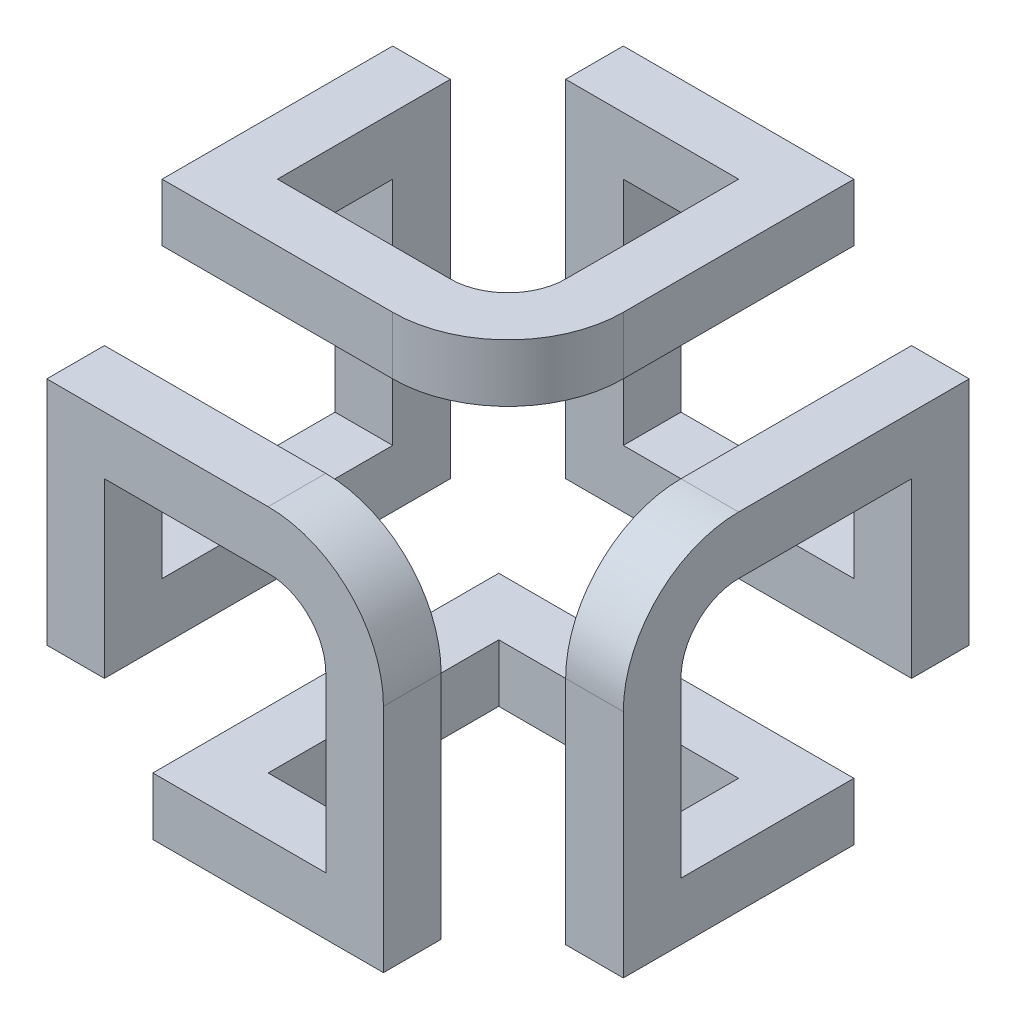
from build123d import *

# Parameters (mm, degrees)
SKETCH_1_W      = 10
SKETCH_1_H      = 10
EXTRUDE_1_DEPTH = 10
EXTRUDE_2_DEPTH = 10
EXTRUDE_3_DEPTH = 10
EXTRUDE_4_DEPTH = 10
EXTRUDE_5_DEPTH = 10
EXTRUDE_6_DEPTH = 10
FILLET_3_R      = 20
FILLET_4_R      = 10
FILLET_5_R      = 20
FILLET_6_R      = 20
FILLET_7_R      = 10
FILLET_8_R      = 10


with BuildPart() as part:
    # 草图1 → 凸台-拉伸1 (new body)
    with BuildSketch(Plane.XY):
        Polygon((0, 60), (0, 30), (10, 30), (10, 50), (48.396471527, 50), (48.396471527, 10), (28.396471527, 10), (28.396471527, 0), (58.396471527, 0), (58.396471527, 60), align=None)
        with Locations((5, 25)):
            Rectangle(SKETCH_1_W, SKETCH_1_H)
        with Locations((23.396471527, 5)):
            Rectangle(SKETCH_1_W, SKETCH_1_H)
    extrude(amount=-EXTRUDE_1_DEPTH)

    # 草图2 → 凸台-拉伸2 (add)
    with BuildSketch(Plane.ZY):
        Polygon((0, 20), (-60, 20), (-60, 80), (-20, 80), (-20, 70), (-50, 70), (-50, 30), (-10, 30), (-10, 60), (0, 60), align=None)
    extrude(amount=-EXTRUDE_2_DEPTH)

    # 草图3 → 凸台-拉伸3 (add)
    with BuildSketch(Plane(origin=(0, 80, 0), x_dir=(1, 0, 0), z_dir=(0, 1, 0))):
        Polygon((0, 60), (0, 20), (60, 20), (60, 80), (20, 80), (20, 70), (50, 70), (50, 30), (10, 30), (10, 60), align=None)
    extrude(amount=-EXTRUDE_3_DEPTH)

    # 草图4 → 凸台-拉伸4 (add)
    with BuildSketch(Plane(origin=(0, 0, -80), x_dir=(-1, 0, 0), z_dir=(0, 0, -1))):
        Polygon((-60, 80), (-20, 80), (-20, 20), (-80, 20), (-80, 60), (-70, 60), (-70, 30), (-30, 30), (-30, 70), (-60, 70), align=None)
    extrude(amount=-EXTRUDE_4_DEPTH)

    # 草图5 → 凸台-拉伸5 (add)
    with BuildSketch(Plane(origin=(80, 0, 0), x_dir=(0, 0, -1), z_dir=(1, 0, 0))):
        Polygon((80, 60), (20, 60), (20, 0), (60, 0), (60, 10), (30, 10), (30, 50), (70, 50), (70, 20), (80, 20), align=None)
    extrude(amount=-EXTRUDE_5_DEPTH)

    # 草图6 → 凸台-拉伸6 (add)
    with BuildSketch(Plane.XZ):
        Polygon((18.396471527, -10), (18.396471527, -60), (70, -60), (70, -50), (28.396471527, -50), (28.396471527, -10), align=None)
    extrude(amount=-EXTRUDE_6_DEPTH)

    # 圆角3
    fillet_3_edges = [part.edges().sort_by_distance(p)[0] for p in [
        (60, 75, -20),
    ]]
    fillet(fillet_3_edges, radius=FILLET_3_R)

    # 圆角4
    fillet_4_edges = [part.edges().sort_by_distance(p)[0] for p in [
        (50, 75, -30),
    ]]
    fillet(fillet_4_edges, radius=FILLET_4_R)

    # 圆角5
    fillet_5_edges = [part.edges().sort_by_distance(p)[0] for p in [
        (75, 60, -20),
    ]]
    fillet(fillet_5_edges, radius=FILLET_5_R)

    # 圆角6
    fillet_6_edges = [part.edges().sort_by_distance(p)[0] for p in [
        (58.396471527, 60, -5),
    ]]
    fillet(fillet_6_edges, radius=FILLET_6_R)

    # 圆角7
    fillet_7_edges = [part.edges().sort_by_distance(p)[0] for p in [
        (48.396471527, 50, -5),
    ]]
    fillet(fillet_7_edges, radius=FILLET_7_R)

    # 圆角8
    fillet_8_edges = [part.edges().sort_by_distance(p)[0] for p in [
        (75, 50, -30),
    ]]
    fillet(fillet_8_edges, radius=FILLET_8_R)


solid = part.part
